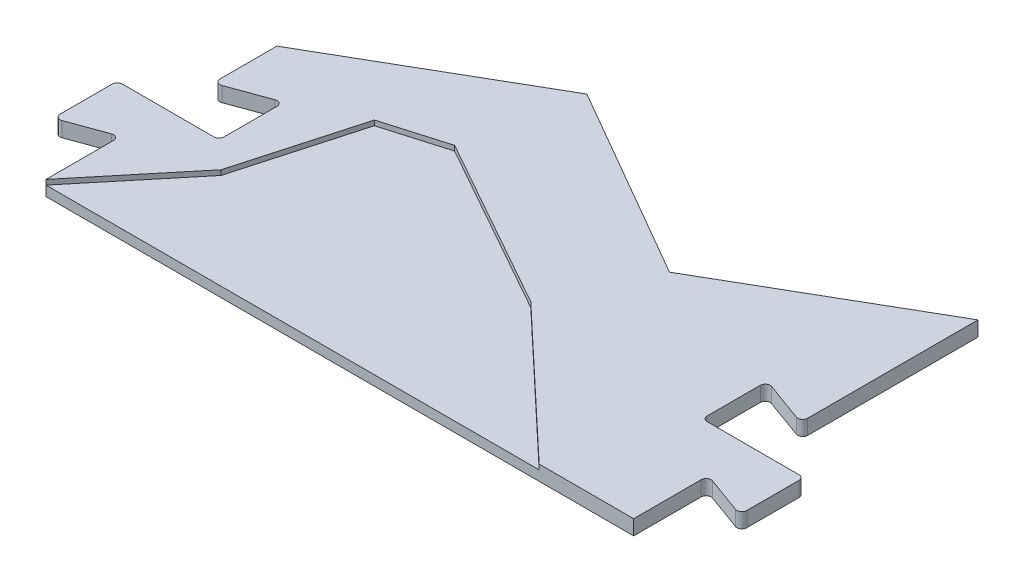
from build123d import *

# Parameters (mm, degrees)
P_IDAT_VYSUNUT_M1_DEPTH = 3
P_IDAT_VYSUNUT_M2_DEPTH = 2
ZAOBLIT3_R              = 1


with BuildPart() as part:
    # Skica1 → Přidat vysunutím1 (new body)
    with BuildSketch(Plane(origin=(0, 0, 0), x_dir=(1, 0, 0), z_dir=(0, 1, 0))):
        Polygon((-118.143750166, 15), (-118.143750166, 0), (-102.227105248, 19.278496169), (-95.473037065, 43.348863075), (-82.997228437, 47.003202833), (-48.112980408, 27.430537213), (-19, 0), (0, 0), (0, 15), (9.950504516, 11.37831254), (9.950504516, 24.27831254), (-10.5, 24.27831254), (-10.5, 37.37831254), (0, 33.55662508), (0, 69.224902673), (-39.317553332, 46.524902673), (-78.635106664, 69.224902673), (-118.143185584, 46.414902673), (-118.143185584, 33.5570142), (-107.643750166, 37.378496169), (-107.643750166, 24.278496169), (-128.093750166, 24.278496169), (-128.093750166, 11.378496169), align=None)
    extrude(amount=P_IDAT_VYSUNUT_M1_DEPTH)

    # Skica1<3> → Přidat vysunutím2 (add)
    with BuildSketch(Plane(origin=(0, 0, 0), x_dir=(1, 0, 0), z_dir=(0, 1, 0))):
        Polygon((-102.227105248, 19.278496169), (-118.143750166, 0), (-19, 0), (-48.112980408, 27.430537213), (-82.997228437, 47.003202833), (-95.473037065, 43.348863075), align=None)
    extrude(amount=P_IDAT_VYSUNUT_M2_DEPTH)

    # Zaoblit3
    zaoblit3_edges = [part.edges().sort_by_distance(p)[0] for p in [
        (-107.643750166, 1.5, -24.278496169),
        (0, 1.5, -15),
        (9.950504516, 1.5, -11.37831254),
        (9.950504516, 1.5, -24.27831254),
        (-10.5, 1.5, -24.27831254),
        (-10.5, 1.5, -37.37831254),
        (0, 1.5, -33.55662508),
        (-118.143750166, 1.5, -15),
        (-128.093750166, 1.5, -11.378496169),
        (-128.093750166, 1.5, -24.278496169),
        (-107.643750166, 1.5, -37.378496169),
        (-118.143185584, 1.5, -33.5570142),
    ]]
    fillet(zaoblit3_edges, radius=ZAOBLIT3_R)


solid = part.part
